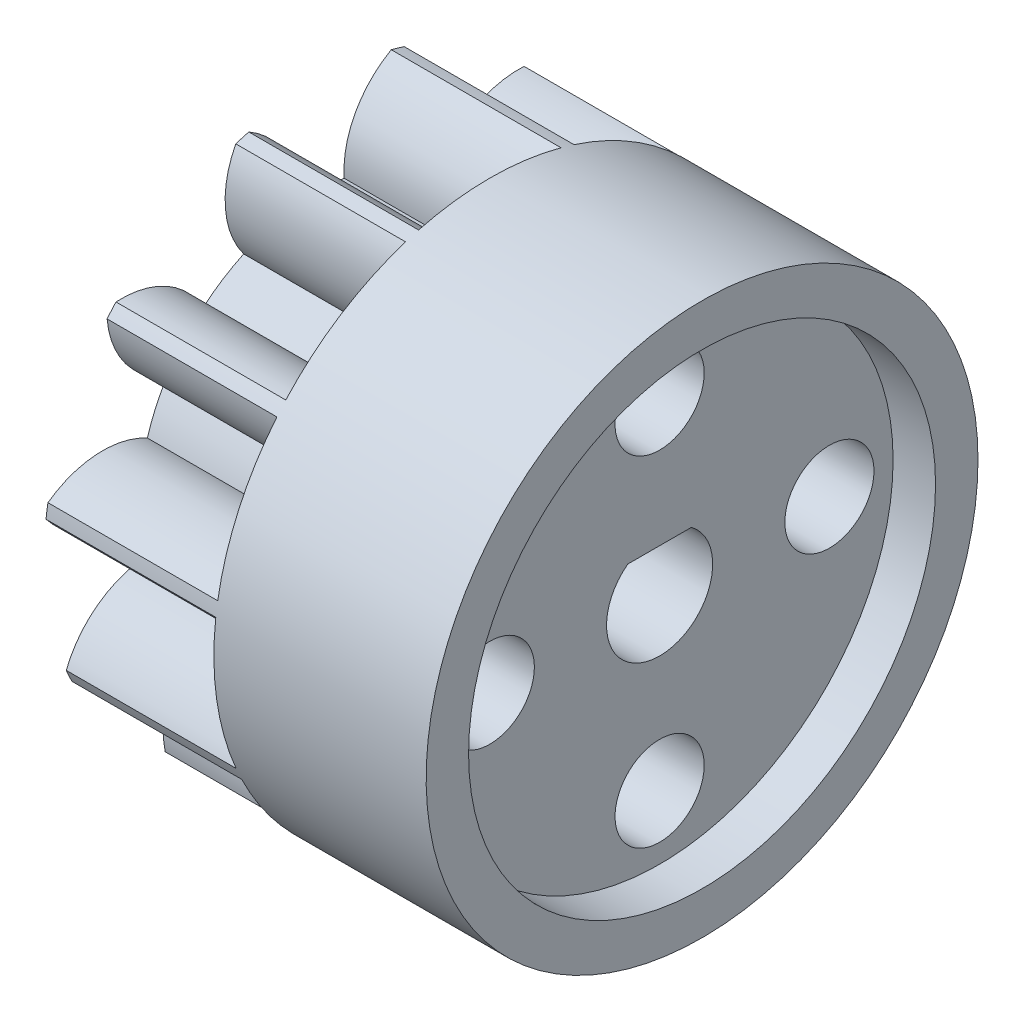
from build123d import *

# Parameters (mm, degrees)
BASPROSKE_W                  = 8
BASPROSKE_H                  = 13
TOOTHCUT_DEPTH               = 21.049937656
TEETHCUTS_COUNT              = 11
TEETHCUTS_ANGLE              = 327.272727273
BORSKE_R                     = 0.4
BORE_DEPTH                   = 50.0000508
ESTRUSIONE_ESTRUSIONE1_START = 10
SCHIZZO2_R                   = 13
ESTRUSIONE_ESTRUSIONE1_DEPTH = 10
TAGLIO_ESTRUSIONE1_DEPTH     = 14
FORO_PER_VITE_M3_1_D         = 4.2
FORO_PER_VITE_M3_1_DEPTH     = 9
FORO_PER_VITE_M3_1_TIP       = 1.2618073
SCHIZZO5_R                   = 11
TAGLIO_ESTRUSIONE2_DEPTH     = 2


with BuildPart() as part:
    # BasProSke → Base-Revolve (revolve)
    with BuildSketch(Plane(origin=(0, 0, 0), x_dir=(1, 0, 0), z_dir=(0, 1, 0)), mode=Mode.PRIVATE) as base_revolve_sk:
        with Locations((4, 6.5)):
            Rectangle(BASPROSKE_W, BASPROSKE_H)
    revolve(base_revolve_sk.sketch.rotate(Axis((-10, 0, 0), (1, 0, 0)), 180), axis=Axis((-10, 0, 0), (1, 0, 0)))

    # TooCutSke → ToothCut (cut, through all)
    with BuildSketch(Plane(origin=(0, 0, 0), x_dir=(0, 0, -1), z_dir=(1, 0, 0))):
        with BuildLine():
            ThreePointArc((1.139858048, 8.422216135), (0, 8.499), (-1.139858048, 8.422216135))
            ThreePointArc((-1.139858048, 8.422216135), (-1.658602184, 10.826907356), (-3.387115532, 12.577300725))
            ThreePointArc((-3.387115532, 12.577300725), (0, 13.0254), (3.387115532, 12.577300725))
            ThreePointArc((3.387115532, 12.577300725), (1.658602184, 10.826907356), (1.139858048, 8.422216135))
        make_face()
    toothcut = extrude(amount=TOOTHCUT_DEPTH, mode=Mode.SUBTRACT)

    # TeethCuts: ToothCut ×11 about axis
    teethcuts_axis = Axis((-10, 0, 0), (1, 0, 0))
    for i in range(1, TEETHCUTS_COUNT):
        add(toothcut.rotate(teethcuts_axis, i * TEETHCUTS_ANGLE / (TEETHCUTS_COUNT - 1)), mode=Mode.SUBTRACT)

    # BorSke → Bore (cut, symmetric)
    with BuildSketch(Plane(origin=(0, 0, 0), x_dir=(0, 0, -1), z_dir=(1, 0, 0))):
        with Locations(Location((0, 0, 0), (0, 0, 180))):
            Circle(BORSKE_R)
    extrude(amount=BORE_DEPTH, both=True, mode=Mode.SUBTRACT)

    # Schizzo2 → Estrusione-Estrusione1 (add)
    with BuildSketch(Plane(origin=(8, 0, 0), x_dir=(0, 0, -1), z_dir=(1, 0, 0)).offset(ESTRUSIONE_ESTRUSIONE1_START)):
        with Locations(Location((0, 0, 0), (0, 0, 173.223714884))):
            Circle(SCHIZZO2_R)
    extrude(amount=-ESTRUSIONE_ESTRUSIONE1_DEPTH)

    # Schizzo1 → Taglio-Estrusione1 (cut)
    with BuildSketch(Plane(origin=(18, 0, 0), x_dir=(0, 0, -1), z_dir=(1, 0, 0))):
        with BuildLine():
            Line((-1.5, 2), (1.5, 2))
            ThreePointArc((1.5, 2), (0, -2.5), (-1.5, 2))
        make_face()
    extrude(amount=-TAGLIO_ESTRUSIONE1_DEPTH, mode=Mode.SUBTRACT)

    # Foro per Vite M3-1
    with Locations(Plane(origin=(18, 0, 0), x_dir=(0, 0, -1), z_dir=(1, 0, 0))):
        with Locations((0, 8), (8, 0), (0, -8), (-8, 0)):
            Hole(FORO_PER_VITE_M3_1_D / 2, depth=FORO_PER_VITE_M3_1_DEPTH)
            with Locations((0, 0, -(FORO_PER_VITE_M3_1_DEPTH + FORO_PER_VITE_M3_1_TIP / 2))):  # 118° drill point
                Cone(0, FORO_PER_VITE_M3_1_D / 2, FORO_PER_VITE_M3_1_TIP, mode=Mode.SUBTRACT)

    # Schizzo5 → Taglio-Estrusione2 (cut)
    with BuildSketch(Plane(origin=(18, 0, 0), x_dir=(0, 0, -1), z_dir=(1, 0, 0))):
        Circle(SCHIZZO5_R)
    extrude(amount=-TAGLIO_ESTRUSIONE2_DEPTH, mode=Mode.SUBTRACT)


solid = part.part
